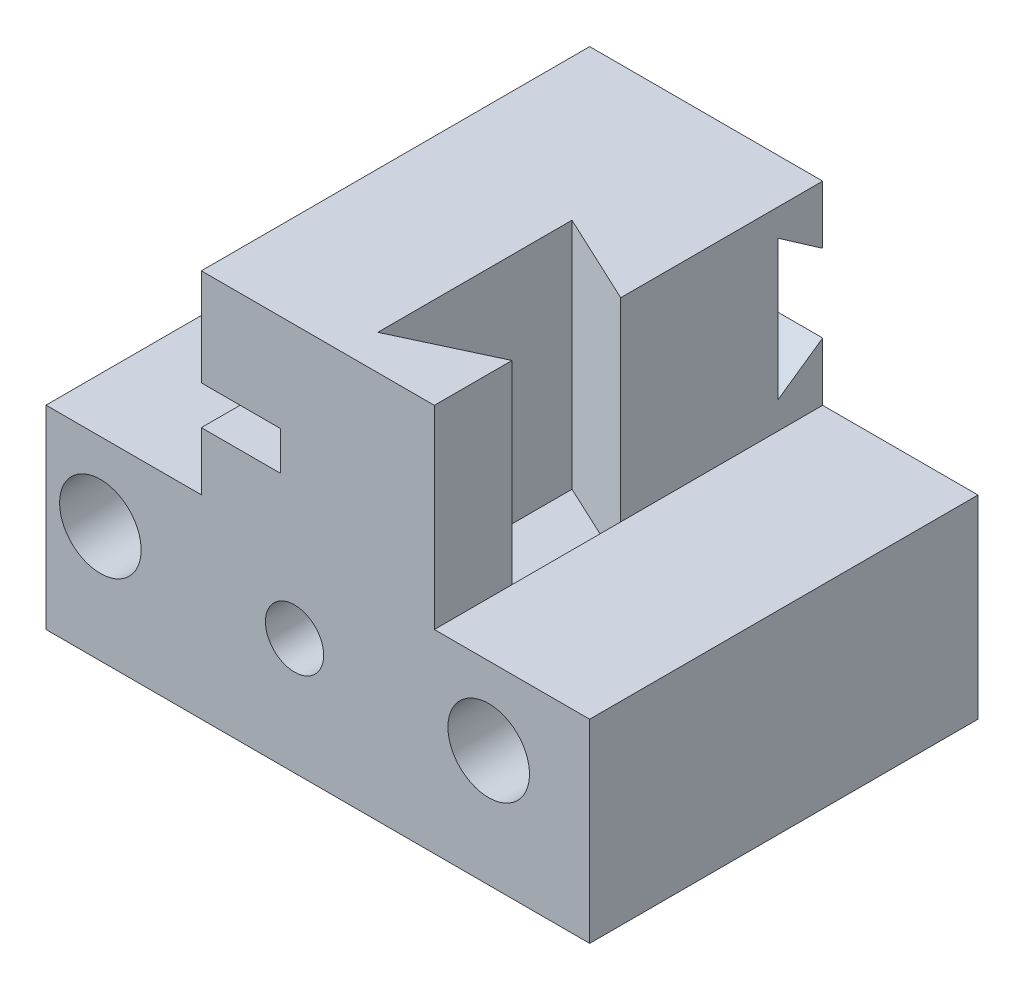
from build123d import *

# Parameters (mm, degrees)
SKETCH1_W                = 7
SKETCH1_H                = 5
BOSS_EXTRUDE1_DEPTH      = 5
HOLE1_D                  = 1.05
HOLE1_CBORE_D            = 1.3
HOLE1_CBORE_DEPTH        = 1.2
SKETCH20_W               = 5
SKETCH20_H               = 2.5
CUT_EXTRUDE11_DEPTH      = 2
M1_0X0_25_TAPPED_HOLE1_D = 0.75
SKETCH37_W               = 5
SKETCH37_H               = 2.5
CUT_EXTRUDE13_DEPTH      = 2
CUT_EXTRUDE15_DEPTH      = 3
CUT_EXTRUDE16_DEPTH      = 9.124038405
SKETCH44_W               = 1.020368792
SKETCH44_H               = 0.499253319
CUT_EXTRUDE17_DEPTH      = 10.197034161


with BuildPart() as part:
    # Sketch1 → Boss-Extrude1 (new body)
    with BuildSketch(Plane(origin=(0, 4, 0), x_dir=(-1, 0, 0), z_dir=(0, 1, 0))):
        with Locations((-3.5, 2.5)):
            Rectangle(SKETCH1_W, SKETCH1_H)
    extrude(amount=-BOSS_EXTRUDE1_DEPTH)

    # Hole1 (through all)
    with Locations(Plane(origin=(0, 0, 0), x_dir=(-1, 0, 0), z_dir=(0, 0, -1))):
        with Locations((-5.7, 0.5), (-0.7, 0.5)):
            CounterBoreHole(HOLE1_D / 2, HOLE1_CBORE_D / 2, HOLE1_CBORE_DEPTH)

    # Sketch20 → Cut-Extrude11 (cut)
    with BuildSketch(Plane(origin=(7, 0, 0), x_dir=(0, 0, -1), z_dir=(1, 0, 0))):
        with Locations((-2.5, 2.75)):
            Rectangle(SKETCH20_W, SKETCH20_H)
    extrude(amount=-CUT_EXTRUDE11_DEPTH, mode=Mode.SUBTRACT)

    # M1.0x0.25 Tapped Hole1 (through all)
    with Locations(Plane(origin=(0, 0, 0), x_dir=(-1, 0, 0), z_dir=(0, 0, -1))):
        with Locations((-3.2, 0.5)):
            Hole(M1_0X0_25_TAPPED_HOLE1_D / 2)

    # Sketch37 → Cut-Extrude13 (cut)
    with BuildSketch(Plane.ZY):
        with Locations((2.5, 2.752068207)):
            Rectangle(SKETCH37_W, SKETCH37_H)
    extrude(amount=-CUT_EXTRUDE13_DEPTH, mode=Mode.SUBTRACT)

    # Sketch41 → Cut-Extrude15 (cut)
    with BuildSketch(Plane(origin=(0, 4, 0), x_dir=(1, 0, 0), z_dir=(0, 1, 0))):
        Polygon((5, -2.6), (3.822078101, -2.05), (3.822078101, -4.55), (5, -4), align=None)
    extrude(amount=-CUT_EXTRUDE15_DEPTH, mode=Mode.SUBTRACT)

    # Sketch43 → Cut-Extrude16 (cut, through all)
    with BuildSketch(Plane.ZY.offset(-2)):
        Polygon((0, 2.250519753), (0.574456265, 1.850519753), (0.574456265, 3.650519753), (0, 3.250519753), align=None)
    extrude(amount=-CUT_EXTRUDE16_DEPTH, mode=Mode.SUBTRACT)

    # Sketch44 → Cut-Extrude17 (cut, through all)
    with BuildSketch(Plane(origin=(0, 0, 0.574456265), x_dir=(-1, 0, 0), z_dir=(0, 0, -1))):
        with Locations((-2.510184396, 2.500893094)):
            Rectangle(SKETCH44_W, SKETCH44_H)
    extrude(amount=-CUT_EXTRUDE17_DEPTH, mode=Mode.SUBTRACT)


solid = part.part
